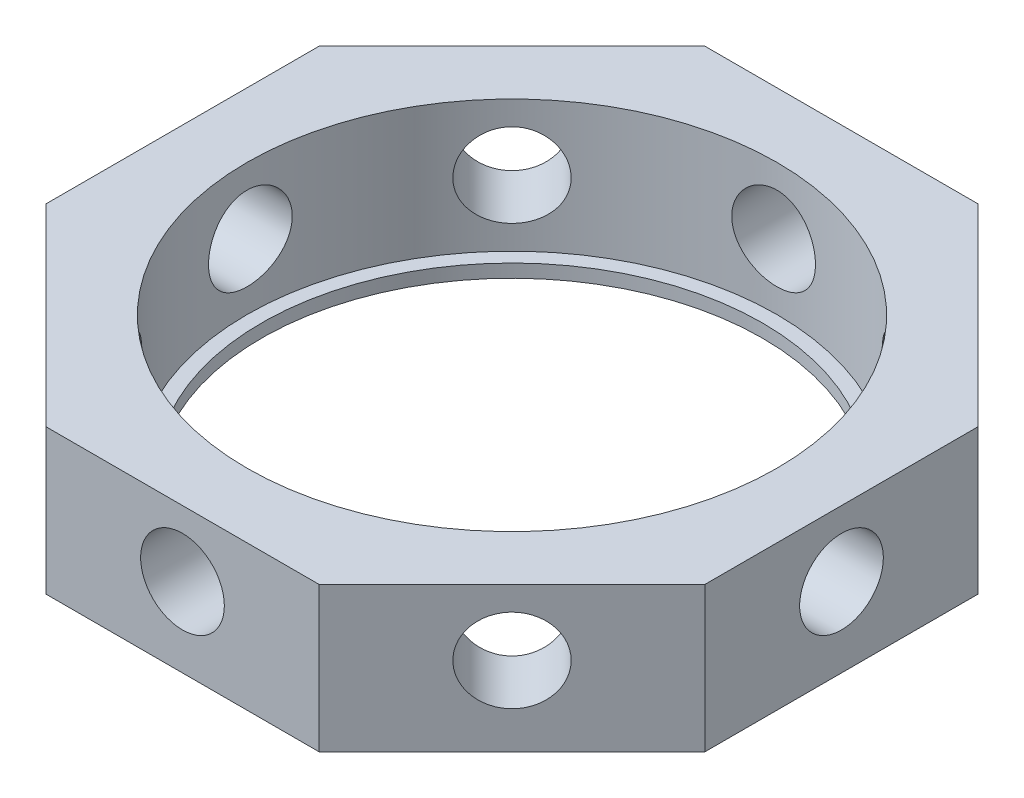
from build123d import *

# Parameters (mm, degrees)
SKETCH1_R           = 51.054
BOSS_EXTRUDE1_DEPTH = 25.4
SKETCH2_R           = 8.0645
CUT_EXTRUDE1_DEPTH  = 31.75
CIRPATTERN1_COUNT   = 8
SKETCH3_R           = 48.26
BOSS_EXTRUDE2_DEPTH = 2.54


with BuildPart() as part:
    # Sketch1 → Boss-Extrude1 (new body)
    with BuildSketch(Plane(origin=(0, 0, 0), x_dir=(1, 0, 0), z_dir=(0, 1, 0))):
        Polygon((63.5, 26.302561211), (26.302561211, 63.5), (-26.302561211, 63.5), (-63.5, 26.302561211), (-63.5, -26.302561211), (-26.302561211, -63.5), (26.302561211, -63.5), (63.5, -26.302561211), align=None)
        with Locations(Location((0, 0, 0), (0, 0, 270))):
            Circle(SKETCH1_R, mode=Mode.SUBTRACT)
    extrude(amount=BOSS_EXTRUDE1_DEPTH)

    # Sketch2 → Cut-Extrude1 (cut)
    with BuildSketch(Plane(origin=(63.5, 0, 0), x_dir=(0, 0, -1), z_dir=(1, 0, 0))):
        with Locations((0, 12.7)):
            Circle(SKETCH2_R)
    cut_extrude1 = extrude(amount=-CUT_EXTRUDE1_DEPTH, mode=Mode.SUBTRACT)

    # CirPattern1: Cut-Extrude1 ×8 about axis
    cirpattern1_axis = Axis((0, 25.4, 0), (0, -1, 0))
    for i in range(1, CIRPATTERN1_COUNT):
        add(cut_extrude1.rotate(cirpattern1_axis, i * 360 / CIRPATTERN1_COUNT), mode=Mode.SUBTRACT)

    # Sketch3 → Boss-Extrude2 (add)
    with BuildSketch(Plane.XZ):
        Polygon((26.302561211, 63.5), (-26.302561211, 63.5), (-63.5, 26.302561211), (-63.5, -26.302561211), (-26.302561211, -63.5), (26.302561211, -63.5), (63.5, -26.302561211), (63.5, 26.302561211), align=None)
        with Locations(Location((0, 0, 0), (0, 0, 270))):
            Circle(SKETCH3_R, mode=Mode.SUBTRACT)
    extrude(amount=BOSS_EXTRUDE2_DEPTH)


solid = part.part
